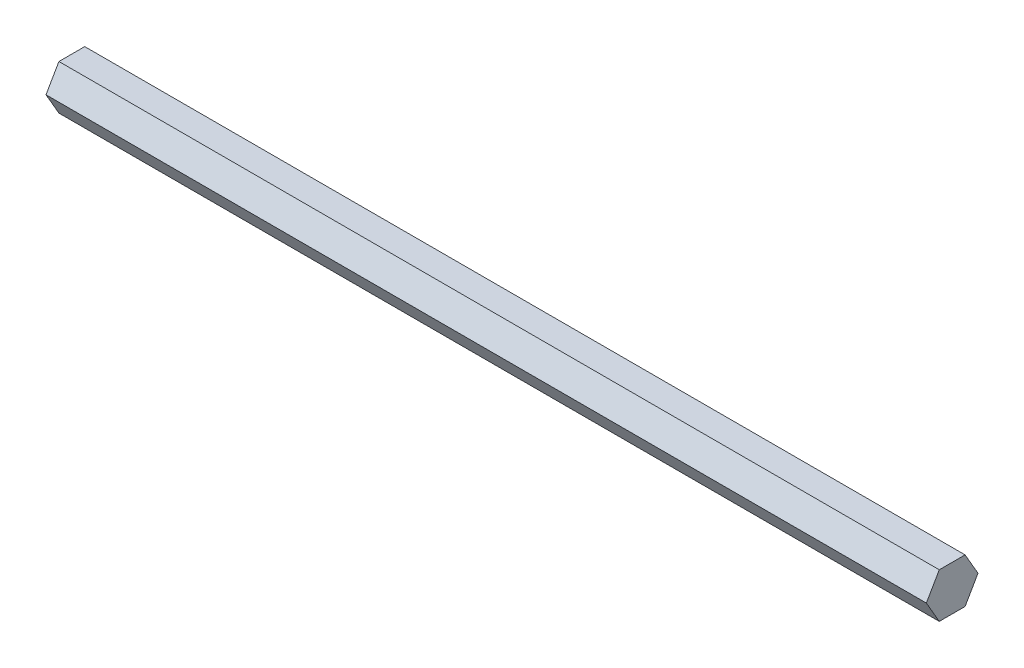
from build123d import *

# Parameters (mm, degrees)
SALIENTE_EXTRUIR1_DEPTH = 250


with BuildPart() as part:
    # Croquis1 → Saliente-Extruir1 (new body)
    with BuildSketch(Plane(origin=(0, 0, 0), x_dir=(0, 0, -1), z_dir=(1, 0, 0))):
        Polygon((7.332348419, 0), (3.666174209, 6.35), (-3.666174209, 6.35), (-7.332348419, 0), (-3.666174209, -6.35), (3.666174209, -6.35), align=None)
    extrude(amount=SALIENTE_EXTRUIR1_DEPTH)


solid = part.part
